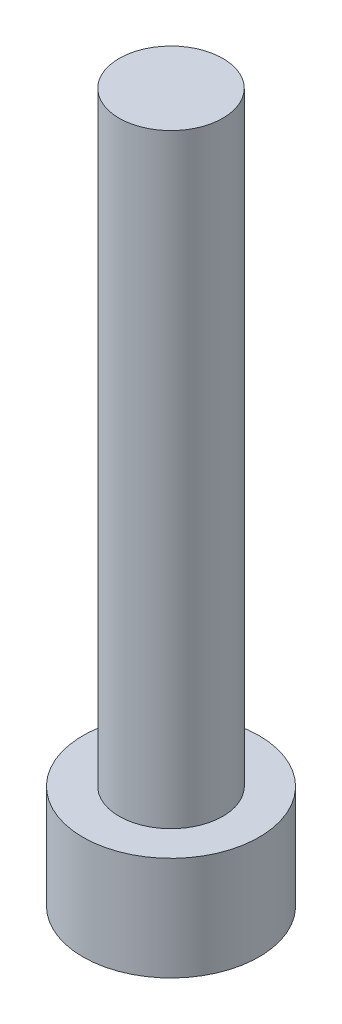
from build123d import *

# Parameters (mm, degrees)
SKETCH_1_R      = 5.1
EXTRUDE_1_DEPTH = 6
SKETCH_2_R      = 3
EXTRUDE_2_DEPTH = 35


with BuildPart() as part:
    # 草图1 → 凸台-拉伸1 (new body)
    with BuildSketch(Plane(origin=(0, 0, 0), x_dir=(1, 0, 0), z_dir=(0, 1, 0))):
        with Locations(Location((0, 0, 0), (0, 0, 270))):
            Circle(SKETCH_1_R)
    extrude(amount=EXTRUDE_1_DEPTH)

    # 草图2 → 凸台-拉伸2 (add)
    with BuildSketch(Plane(origin=(0, 6, 0), x_dir=(1, 0, 0), z_dir=(0, 1, 0))):
        with Locations(Location((0, 0, 0), (0, 0, 270))):
            Circle(SKETCH_2_R)
    extrude(amount=EXTRUDE_2_DEPTH)


solid = part.part
